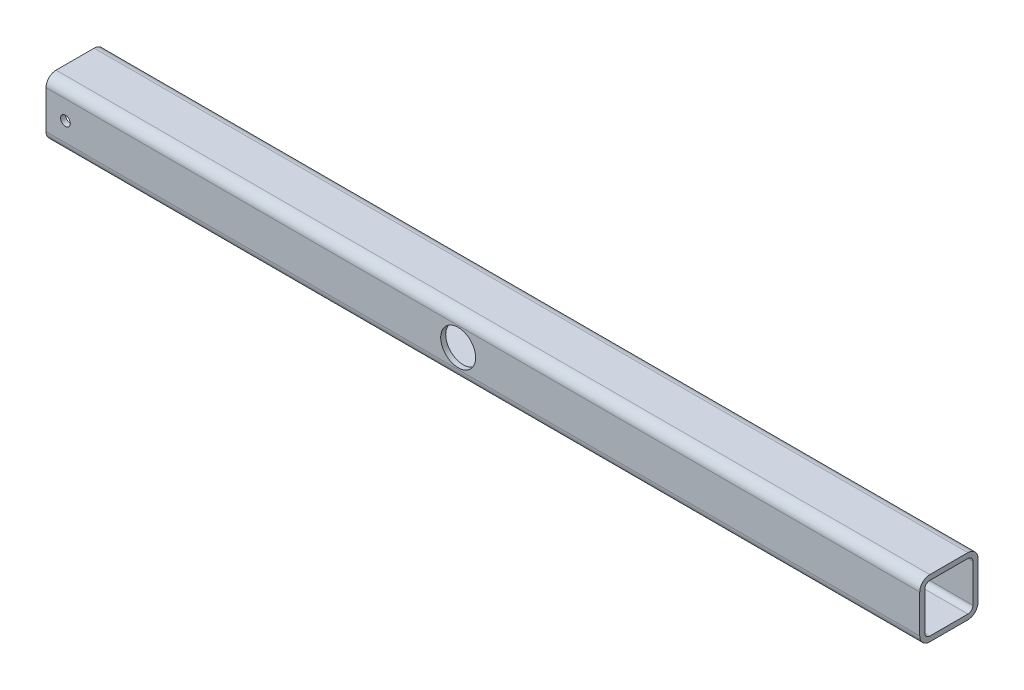
from build123d import *

# Parameters (mm, degrees)
RURA_KWADRATOWA_30_X_30_X_2_6_1_DEPTH = 450
SZKIC2_R                              = 2.5
SZKIC2_R_2                            = 9
WYTNIJ_WYCI_GNI_CIE1_DEPTH            = 228.486263322


with BuildPart() as part:
    # Sketch1 → Rura kwadratowa 30 X 30 X 2.6(1) (new body)
    with BuildSketch(Plane(origin=(-225, 0, 0), x_dir=(0, 0, -1), z_dir=(1, 0, 0))):
        with BuildLine():
            Line((-9.8, -15), (9.8, -15))
            ThreePointArc((9.8, -15), (13.476955262, -13.476955262), (15, -9.8))
            Line((15, -9.8), (15, 9.8))
            ThreePointArc((15, 9.8), (13.476955262, 13.476955262), (9.8, 15))
            Line((9.8, 15), (-9.8, 15))
            ThreePointArc((-9.8, 15), (-13.476955262, 13.476955262), (-15, 9.8))
            Line((-15, 9.8), (-15, -9.8))
            ThreePointArc((-15, -9.8), (-13.476955262, -13.476955262), (-9.8, -15))
        make_face()
        with BuildLine():
            Line((-9.8, -12.4), (9.8, -12.4))
            ThreePointArc((9.8, -12.4), (11.638477631, -11.638477631), (12.4, -9.8))
            Line((12.4, -9.8), (12.4, 9.8))
            ThreePointArc((12.4, 9.8), (11.638477631, 11.638477631), (9.8, 12.4))
            Line((9.8, 12.4), (-9.8, 12.4))
            ThreePointArc((-9.8, 12.4), (-11.638477631, 11.638477631), (-12.4, 9.8))
            Line((-12.4, 9.8), (-12.4, -9.8))
            ThreePointArc((-12.4, -9.8), (-11.638477631, -11.638477631), (-9.8, -12.4))
        make_face(mode=Mode.SUBTRACT)
    extrude(amount=RURA_KWADRATOWA_30_X_30_X_2_6_1_DEPTH)

    # Szkic2 → Wytnij-wyciągnięcie1 (cut, through all)
    with BuildSketch(Plane.XY.offset(15)):
        with Locations((-215, 0)):
            Circle(SZKIC2_R)
        with Locations((-12.73, 0)):
            Circle(SZKIC2_R_2)
    extrude(amount=-WYTNIJ_WYCI_GNI_CIE1_DEPTH, mode=Mode.SUBTRACT)


solid = part.part
